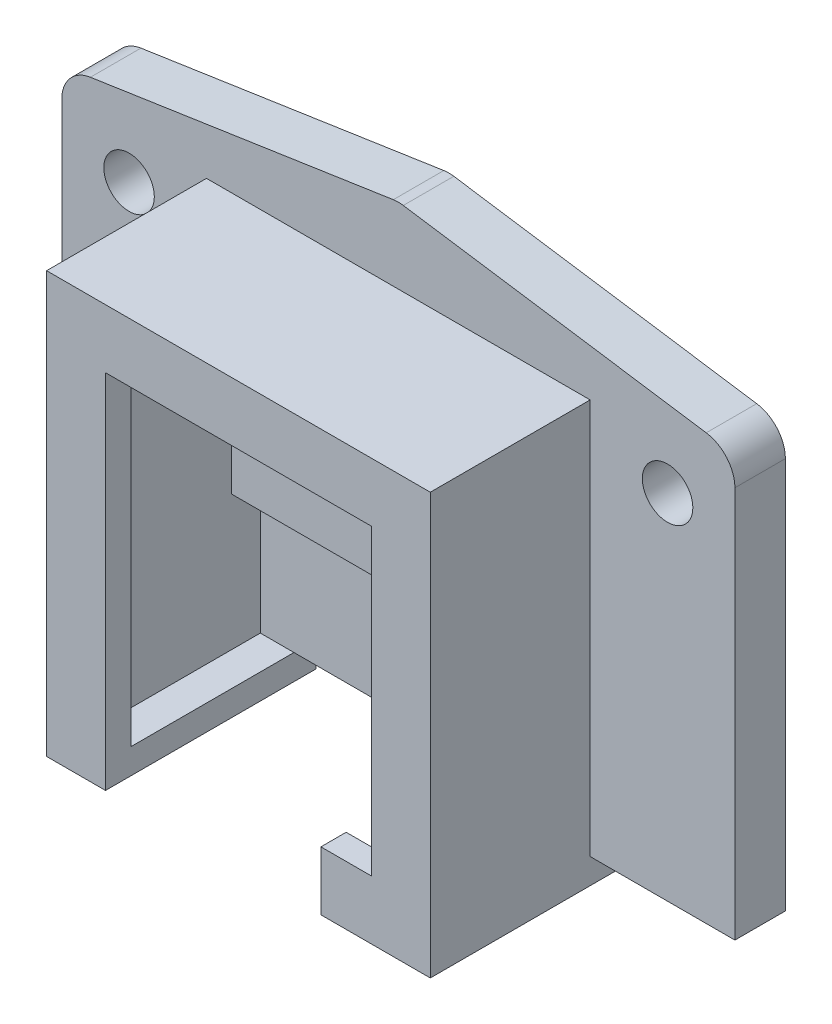
from build123d import *

# Parameters (mm, degrees)
CROQUIS1_R              = 1.5
SALIENTE_EXTRUIR1_DEPTH = 3
SALIENTE_EXTRUIR2_DEPTH = 8
CROQUIS3_W              = 13
CROQUIS3_H              = 1.7
CORTAR_EXTRUIR1_DEPTH   = 8
CROQUIS5_W              = 3.5
CROQUIS5_H              = 11
CROQUIS5_W_2            = 6.5
SALIENTE_EXTRUIR3_DEPTH = 1.5
SALIENTE_EXTRUIR4_DEPTH = 1.5


with BuildPart() as part:
    # Croquis1 → Saliente-Extruir1 (new body)
    with BuildSketch(Plane.XY):
        with BuildLine():
            Line((-55.603283504, 22.637490201), (-73.603283504, 19.937490201))
            ThreePointArc((-73.603283504, 19.937490201), (-74.822083019, 19.26473017), (-75.306602598, 17.959617496))
            Line((-75.306602598, 17.959617496), (-75.306602598, -5.318007663))
            Line((-75.306602598, -5.318007663), (-35.306602598, -5.318007663))
            Line((-35.306602598, -5.318007663), (-35.306602598, 17.959617496))
            ThreePointArc((-35.306602598, 17.959617496), (-35.791122177, 19.26473017), (-37.009921692, 19.937490201))
            Line((-37.009921692, 19.937490201), (-55.009921692, 22.637490201))
            ThreePointArc((-55.009921692, 22.637490201), (-55.306602598, 22.659617496), (-55.603283504, 22.637490201))
        make_face()
        with Locations((-71.306602598, 15.681992337)):
            Circle(CROQUIS1_R, mode=Mode.SUBTRACT)
        with Locations((-39.306602598, 15.681992337)):
            Circle(CROQUIS1_R, mode=Mode.SUBTRACT)
    extrude(amount=SALIENTE_EXTRUIR1_DEPTH)

    # Croquis2 → Saliente-Extruir2 (add)
    with BuildSketch(Plane.XY.offset(3)):
        Polygon((-66.706602598, -5.318007663), (-65.206602598, -5.318007663), (-65.206602598, 16.681992337), (-45.406602598, 16.681992337), (-45.406602598, -5.318007663), (-43.906602598, -5.318007663), (-43.906602598, 18.181992337), (-66.706602598, 18.181992337), align=None)
    extrude(amount=SALIENTE_EXTRUIR2_DEPTH)

    # Croquis3 → Cortar-Extruir1 (cut)
    with BuildSketch(Plane.XZ.offset(5.318007663)):
        with Locations((-58.706602598, 2.15)):
            Rectangle(CROQUIS3_W, CROQUIS3_H)
    extrude(amount=-CORTAR_EXTRUIR1_DEPTH, mode=Mode.SUBTRACT)

    # Croquis5 → Saliente-Extruir3 (add)
    with BuildSketch(Plane.XZ.offset(5.318007663)):
        with Locations((-64.956602598, 5.5)):
            Rectangle(CROQUIS5_W, CROQUIS5_H)
        with Locations((-47.156602598, 5.5)):
            Rectangle(CROQUIS5_W_2, CROQUIS5_H)
    extrude(amount=SALIENTE_EXTRUIR3_DEPTH)

    # Croquis6 → Saliente-Extruir4 (add)
    with BuildSketch(Plane.XY.offset(11)):
        Polygon((-63.206602598, -5.318007663), (-63.206602598, -6.818007663), (-66.706602598, -6.818007663), (-66.706602598, 18.181992337), (-43.906602598, 18.181992337), (-43.906602598, -6.818007663), (-50.406602598, -6.818007663), (-50.406602598, -3.318007663), (-47.406602598, -3.318007663), (-47.406602598, 14.681992337), (-63.206602598, 14.681992337), align=None)
    extrude(amount=SALIENTE_EXTRUIR4_DEPTH)


solid = part.part
